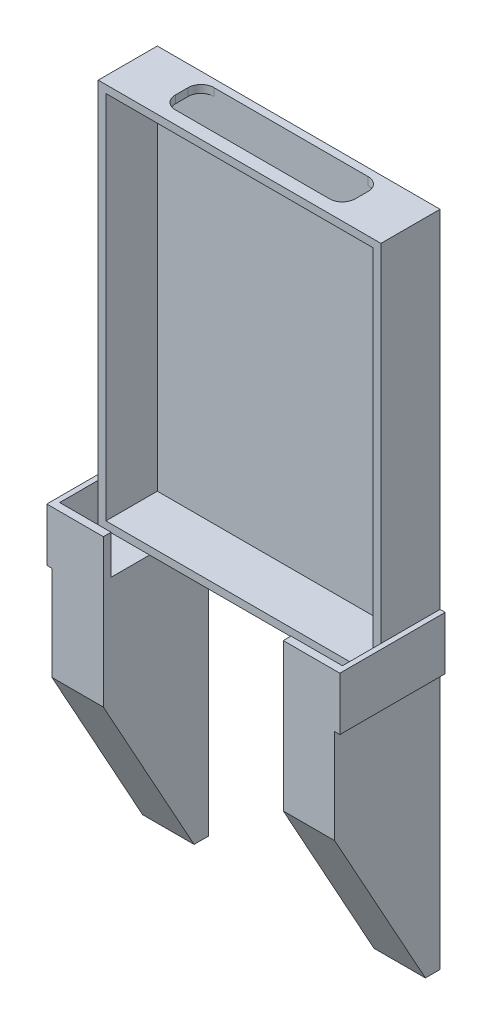
from build123d import *

# Parameters (mm, degrees)
SKETCH_1_W          = 110
SKETCH_1_H          = 150
EXTRUDE_1_DEPTH     = 3
SKETCH_2_W          = 110
SKETCH_2_H          = 150
SKETCH_2_W_2        = 104
SKETCH_2_H_2        = 144
EXTRUDE_2_DEPTH     = 20
EXTRUDE_3_DEPTH     = 20
SKETCH_4_W          = 41
SKETCH_4_H          = 20.685891883
EXTRUDE_4_DEPTH     = 2
SKETCH_5_W          = 70
SKETCH_5_H          = 15
CUT_EXTRUDE_1_DEPTH = 8
FILLET_1_R          = 5


with BuildPart() as part:
    # 草图1 → 凸台-拉伸1 (new body)
    with BuildSketch(Plane.XY):
        Rectangle(SKETCH_1_W, SKETCH_1_H)
    extrude(amount=EXTRUDE_1_DEPTH)

    # 草图2 → 凸台-拉伸2 (add)
    with BuildSketch(Plane.XY.offset(3)):
        Rectangle(SKETCH_2_W, SKETCH_2_H)
        Rectangle(SKETCH_2_W_2, SKETCH_2_H_2, mode=Mode.SUBTRACT)
    extrude(amount=EXTRUDE_2_DEPTH)

    # 草图3 → 凸台-拉伸3 (add)
    with BuildSketch(Plane.ZY.offset(55)):
        Polygon((23, -75), (38, -75), (38, -59.816209212), (41, -59.816209212), (41, -117.234969842), (5.700174456, -181.163787756), (0, -181.163787756), (0, -75), align=None)
    extrude_3 = extrude(amount=-EXTRUDE_3_DEPTH)

    # 草图4 → 凸台-拉伸4 (add)
    with BuildSketch(Plane.ZY.offset(55)):
        with Locations((20.5, -70.159155153)):
            Rectangle(SKETCH_4_W, SKETCH_4_H)
    extrude_4 = extrude(amount=EXTRUDE_4_DEPTH)

    # 草图5 → 切除-拉伸1 (cut)
    with BuildSketch(Plane(origin=(0, 75, 0), x_dir=(1, 0, 0), z_dir=(0, 1, 0))):
        with Locations((0, -10.5)):
            Rectangle(SKETCH_5_W, SKETCH_5_H)
    extrude(amount=-CUT_EXTRUDE_1_DEPTH, mode=Mode.SUBTRACT)

    # 圆角1
    fillet_1_edges = [part.edges().sort_by_distance(p)[0] for p in [
        (-35, 73.5, 18),
        (-35, 73.5, 3),
        (35, 73.5, 3),
        (35, 73.5, 18),
    ]]
    fillet(fillet_1_edges, radius=FILLET_1_R)

    # 镜向1: 凸台-拉伸4 across plane
    add(extrude_4.mirror(Plane(origin=(0, 0, 0), x_dir=(0, 0, 1), z_dir=(1, 0, 0))))

    # 镜向2: 凸台-拉伸3 across plane
    add(extrude_3.mirror(Plane(origin=(0, 0, 0), x_dir=(0, 0, 1), z_dir=(1, 0, 0))))


solid = part.part
